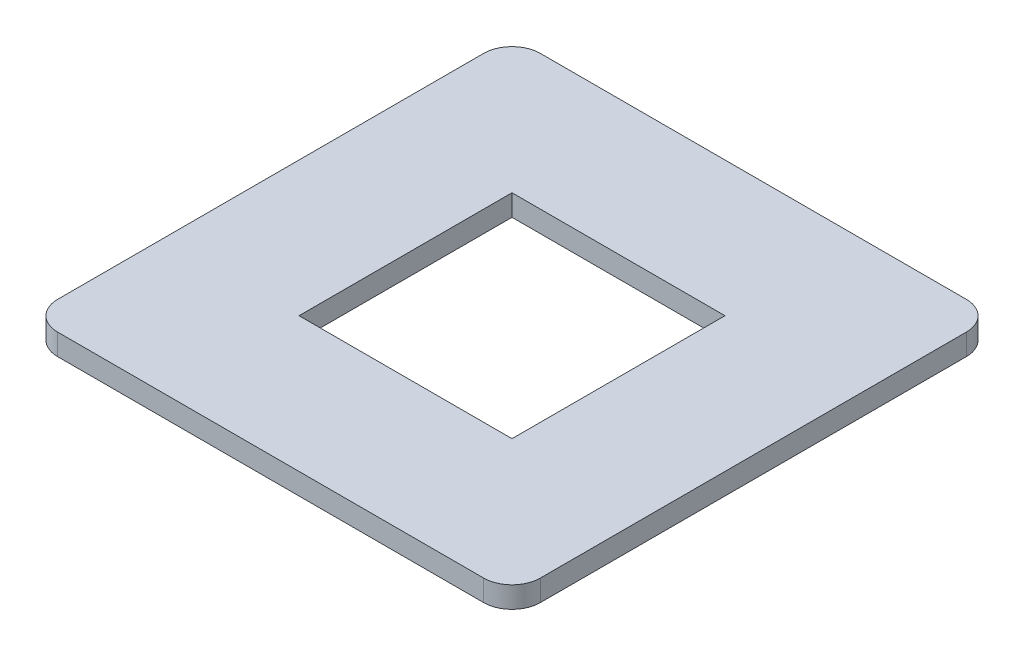
from build123d import *

# Parameters (mm, degrees)
SKETCH2_W  = 170
SKETCH2_H  = 170
BASE_DEPTH = 7.5
SKETCH3_W  = 75
SKETCH3_H  = 75
HOLE_DEPTH = 7.5
FILLET1_R  = 10


with BuildPart() as part:
    # Sketch2 → Base (new body)
    with BuildSketch(Plane(origin=(0, 0, 0), x_dir=(1, 0, 0), z_dir=(0, 1, 0))):
        Rectangle(SKETCH2_W, SKETCH2_H)
    extrude(amount=BASE_DEPTH)

    # Sketch3 → Hole (cut)
    with BuildSketch(Plane(origin=(0, 7.5, 0), x_dir=(1, 0, 0), z_dir=(0, 1, 0))):
        Rectangle(SKETCH3_W, SKETCH3_H)
    extrude(amount=-HOLE_DEPTH, mode=Mode.SUBTRACT)

    # Fillet1
    fillet1_edges = [part.edges().sort_by_distance(p)[0] for p in [
        (85, 3.75, 85),
        (-85, 3.75, 85),
        (-85, 3.75, -85),
        (85, 3.75, -85),
    ]]
    fillet(fillet1_edges, radius=FILLET1_R)


solid = part.part
